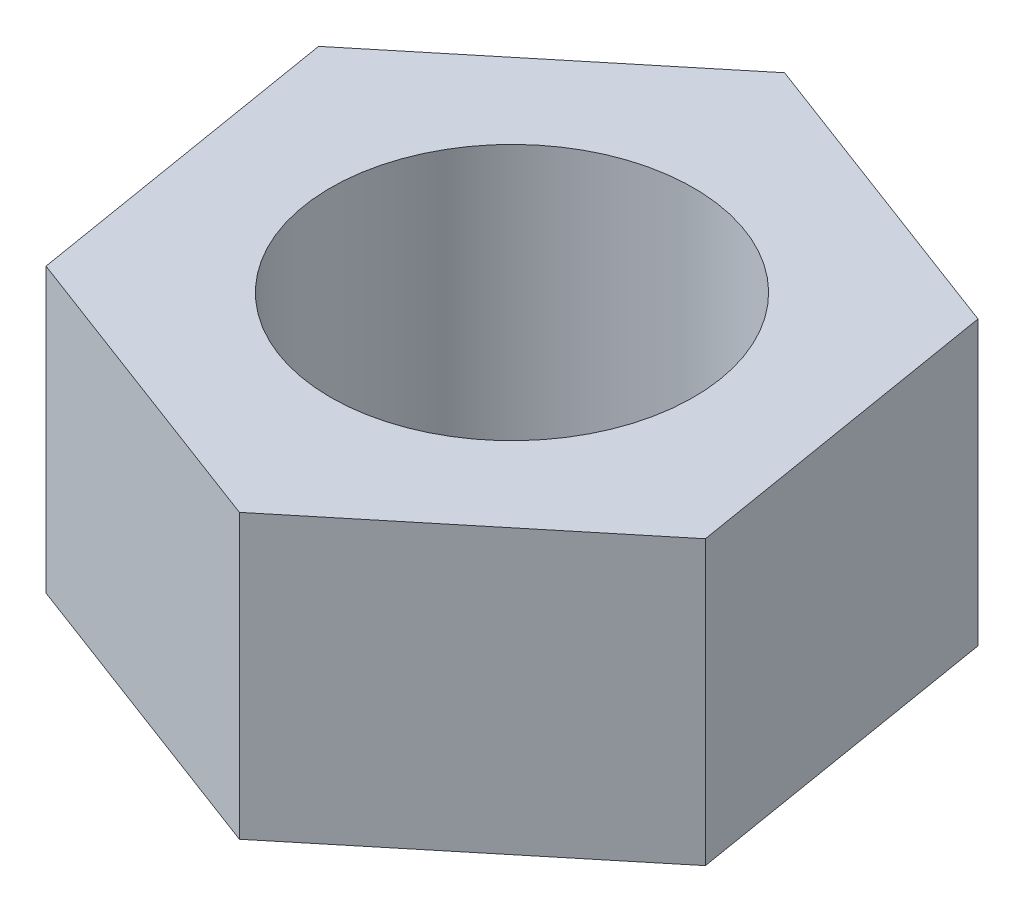
from build123d import *

# Parameters (mm, degrees)
SKETCH1_R           = 2.5
BOSS_EXTRUDE1_DEPTH = 3.9


with BuildPart() as part:
    # Sketch1 → Boss-Extrude1 (new body)
    with BuildSketch(Plane(origin=(0, 0, 0), x_dir=(1, 0, 0), z_dir=(0, 1, 0))):
        Polygon((3.524697707, 2.894795227), (-0.744617351, 4.499875369), (-4.269315059, 1.605080142), (-3.524697707, -2.894795227), (0.744617351, -4.499875369), (4.269315059, -1.605080142), align=None)
        with Locations(Location((0, 0, 0), (0, 0, 270))):
            Circle(SKETCH1_R, mode=Mode.SUBTRACT)
    extrude(amount=BOSS_EXTRUDE1_DEPTH)


solid = part.part
